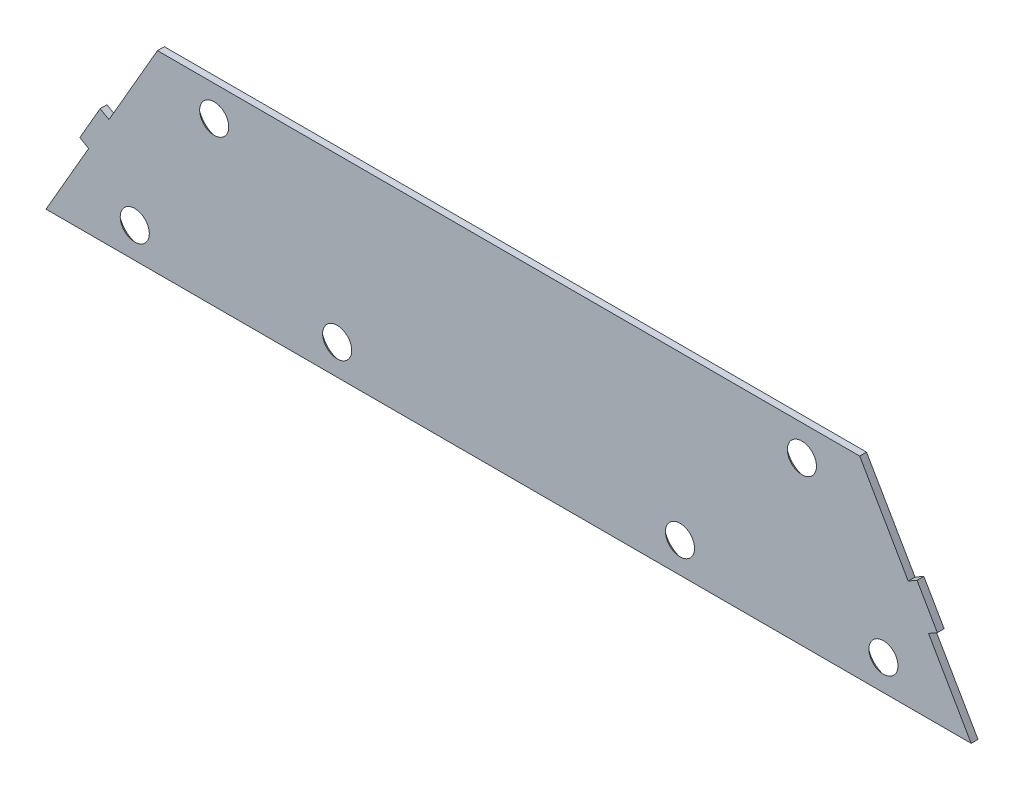
from build123d import *

# Parameters (mm, degrees)
BOSS_EXTRUDE1_DEPTH                       = 1.0668
CSK_FOR_6_FLAT_HEAD_MACHINE_SCREW_2_COUNT = 2
CSK_FOR_6_FLAT_HEAD_MACHINE_SCREW_2_PITCH = 75.64076181
CSK_FOR_6_FLAT_HEAD_MACHINE_SCREW_3_COUNT = 2
CSK_FOR_6_FLAT_HEAD_MACHINE_SCREW_3_PITCH = 28.085742046
CSK_FOR_6_FLAT_HEAD_MACHINE_SCREW_4_COUNT = 2
CSK_FOR_6_FLAT_HEAD_MACHINE_SCREW_4_PITCH = 31.783974209
CSK_FOR_6_FLAT_HEAD_MACHINE_SCREW_5_COUNT = 2
CSK_FOR_6_FLAT_HEAD_MACHINE_SCREW_5_PITCH = 85.183025791
CSK_FOR_6_FLAT_HEAD_MACHINE_SCREW_6_COUNT = 2
CSK_FOR_6_FLAT_HEAD_MACHINE_SCREW_6_PITCH = 53.560025791
CUT_EXTRUDE1_DEPTH                        = 78.375632316


with BuildPart() as part:
    # Sketch1 → Boss-Extrude1 (new body)
    with BuildSketch(Plane.XY):
        Polygon((-55.191374672, 13.731073684), (-72.605702167, -16.431426316), (75.603297833, -16.431426316), (58.188970339, 13.731073684), align=None)
    extrude(amount=BOSS_EXTRUDE1_DEPTH)

    # Sketch2 → CSK for #6 Flat Head Machine Screw (100)1 (revolve, cut)
    with BuildSketch(Plane(origin=(28.278810729, -11.668926316, 0), x_dir=(0, 1, 0), z_dir=(1, 0, 0))):
        Polygon((0, 0), (0, 1.0668), (1.89865, 1.0668), (1.89865, 1.380025208), (3.5433, 0), align=None)
    csk_for_6_flat_head_machine_screw_100 = revolve(axis=Axis((28.278810729, -11.668926316, -6.35), (0, 0, 1)), mode=Mode.SUBTRACT)

    # CSK for _6 Flat Head Machine Screw _ 2: CSK for #6 Flat Head Machine Screw (100)1 ×2
    with Locations(*[Vector(-0.9620606437367123, 0.27283569739479224, 0) * (i * CSK_FOR_6_FLAT_HEAD_MACHINE_SCREW_2_PITCH) for i in range(1, CSK_FOR_6_FLAT_HEAD_MACHINE_SCREW_2_COUNT)]):
        add(csk_for_6_flat_head_machine_screw_100, mode=Mode.SUBTRACT)

    # CSK for _6 Flat Head Machine Screw _ 3: CSK for #6 Flat Head Machine Screw (100)1 ×2
    with Locations(*[Vector(0.6782801027330659, 0.7348034446274878, 0) * (i * CSK_FOR_6_FLAT_HEAD_MACHINE_SCREW_3_PITCH) for i in range(1, CSK_FOR_6_FLAT_HEAD_MACHINE_SCREW_3_COUNT)]):
        add(csk_for_6_flat_head_machine_screw_100, mode=Mode.SUBTRACT)

    # CSK for _6 Flat Head Machine Screw _ 4: CSK for #6 Flat Head Machine Screw (100)1 ×2
    with Locations(*[(i * CSK_FOR_6_FLAT_HEAD_MACHINE_SCREW_4_PITCH, 0, 0) for i in range(1, CSK_FOR_6_FLAT_HEAD_MACHINE_SCREW_4_COUNT)]):
        add(csk_for_6_flat_head_machine_screw_100, mode=Mode.SUBTRACT)

    # CSK for _6 Flat Head Machine Screw _ 5: CSK for #6 Flat Head Machine Screw (100)1 ×2
    with Locations(*[(-i * CSK_FOR_6_FLAT_HEAD_MACHINE_SCREW_5_PITCH, 0, 0) for i in range(1, CSK_FOR_6_FLAT_HEAD_MACHINE_SCREW_5_COUNT)]):
        add(csk_for_6_flat_head_machine_screw_100, mode=Mode.SUBTRACT)

    # CSK for _6 Flat Head Machine Screw _ 6: CSK for #6 Flat Head Machine Screw (100)1 ×2
    with Locations(*[(-i * CSK_FOR_6_FLAT_HEAD_MACHINE_SCREW_6_PITCH, 0, 0) for i in range(1, CSK_FOR_6_FLAT_HEAD_MACHINE_SCREW_6_COUNT)]):
        add(csk_for_6_flat_head_machine_screw_100, mode=Mode.SUBTRACT)

    # Sketch4 → Cut-Extrude1 (cut, through all)
    with BuildSketch(Plane(origin=(0, 0, 0), x_dir=(-1, 0, 0), z_dir=(0, 0, -1))):
        Polygon((-65.308634086, 1.399454341), (-63.933818758, 0.605704341), (-56.355883234, 13.731073684), (-58.188970339, 13.731073684), align=None)
        Polygon((-68.483634086, -4.099806973), (-67.108818758, -4.893556973), (-73.770210729, -16.431426316), (-75.603297833, -16.431426316), align=None)
    cut_extrude1 = extrude(amount=-CUT_EXTRUDE1_DEPTH, mode=Mode.SUBTRACT)

    # Mirror1: Cut-Extrude1 across plane
    add(cut_extrude1.mirror(Plane.ZY.offset(-1.498797833)), mode=Mode.SUBTRACT)


solid = part.part
